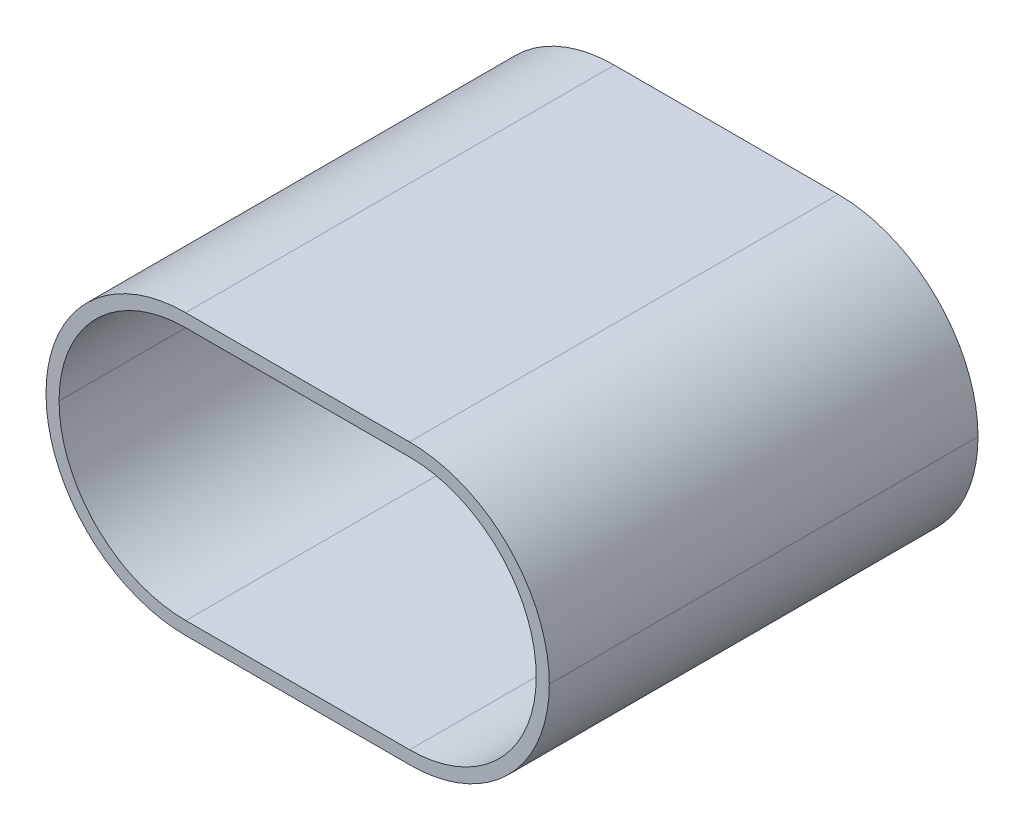
from build123d import *

# Parameters (mm, degrees)
EXTRUSION1_DEPTH        = 24
ENL_V_MAT_EXTRU_1_DEPTH = 1
EXTRUSION2_START        = -1
EXTRUSION2_DEPTH        = 1


with BuildPart() as part:
    # Esquisse1 → Extrusion1 (new body)
    with BuildSketch(Plane.XY):
        with BuildLine():
            Line((-8.829098079, -21.6), (3.180901921, -21.6))
            ThreePointArc((3.180901921, -21.6), (8.477131712, -19.406229791), (10.670901921, -14.11))
            Line((10.670901921, -14.11), (10.670901921, -14.1))
            ThreePointArc((10.670901921, -14.1), (8.47420278, -8.796699141), (3.170901921, -6.6))
            Line((3.170901921, -6.6), (-8.839098079, -6.6))
            ThreePointArc((-8.839098079, -6.6), (-14.13532787, -8.793770209), (-16.329098079, -14.09))
            Line((-16.329098079, -14.09), (-16.329098079, -14.1))
            ThreePointArc((-16.329098079, -14.1), (-14.132398938, -19.403300859), (-8.829098079, -21.6))
        make_face()
        with BuildLine():
            Line((3.170901921, -7.3), (-8.839098079, -7.3))
            ThreePointArc((-8.839098079, -7.3), (-13.640353124, -9.288744956), (-15.629098079, -14.09))
            Line((-15.629098079, -14.09), (-15.629098079, -14.1))
            ThreePointArc((-15.629098079, -14.1), (-13.637424191, -18.908326112), (-8.829098079, -20.9))
            Line((-8.829098079, -20.9), (3.180901921, -20.9))
            ThreePointArc((3.180901921, -20.9), (7.982156965, -18.911255044), (9.970901921, -14.11))
            Line((9.970901921, -14.11), (9.970901921, -14.1))
            ThreePointArc((9.970901921, -14.1), (7.979228033, -9.291673888), (3.170901921, -7.3))
        make_face(mode=Mode.SUBTRACT)
    extrude(amount=-EXTRUSION1_DEPTH)

    # Esquisse2 → Enlèv. mat.-Extru.1 (cut)
    with BuildSketch(Plane.XY):
        with BuildLine():
            Line((-8.829098079, -21.6), (3.180901921, -21.6))
            ThreePointArc((3.180901921, -21.6), (8.477131712, -19.406229791), (10.670901921, -14.11))
            Line((10.670901921, -14.11), (10.670901921, -14.1))
            ThreePointArc((10.670901921, -14.1), (8.47420278, -8.796699141), (3.170901921, -6.6))
            Line((3.170901921, -6.6), (-8.839098079, -6.6))
            ThreePointArc((-8.839098079, -6.6), (-14.13532787, -8.793770209), (-16.329098079, -14.09))
            Line((-16.329098079, -14.09), (-16.329098079, -14.1))
            ThreePointArc((-16.329098079, -14.1), (-14.132398938, -19.403300859), (-8.829098079, -21.6))
        make_face()
    extrude(amount=-ENL_V_MAT_EXTRU_1_DEPTH, mode=Mode.SUBTRACT)

    # Esquisse3 → Extrusion2 (add)
    with BuildSketch(Plane(origin=(0, 0, -24), x_dir=(-1, 0, 0), z_dir=(0, 0, -1)).offset(EXTRUSION2_START)):
        with BuildLine():
            Line((16.329098079, -14.1), (16.329098079, -14.09))
            ThreePointArc((16.329098079, -14.09), (14.13532787, -8.793770209), (8.839098079, -6.6))
            Line((8.839098079, -6.6), (-3.170901921, -6.6))
            ThreePointArc((-3.170901921, -6.6), (-8.47420278, -8.796699141), (-10.670901921, -14.1))
            Line((-10.670901921, -14.1), (-10.670901921, -14.11))
            ThreePointArc((-10.670901921, -14.11), (-8.477131712, -19.406229791), (-3.180901921, -21.6))
            Line((-3.180901921, -21.6), (8.829098079, -21.6))
            ThreePointArc((8.829098079, -21.6), (14.132398938, -19.403300859), (16.329098079, -14.1))
        make_face()
        with BuildLine():
            Line((8.839098079, -9.1), (-3.170901921, -9.1))
            ThreePointArc((-3.170901921, -9.1), (-6.706435827, -10.564466094), (-8.170901921, -14.1))
            Line((-8.170901921, -14.1), (-8.170901921, -14.11))
            ThreePointArc((-8.170901921, -14.11), (-6.709364759, -17.638462838), (-3.180901921, -19.1))
            Line((-3.180901921, -19.1), (8.829098079, -19.1))
            ThreePointArc((8.829098079, -19.1), (12.364631985, -17.635533906), (13.829098079, -14.1))
            Line((13.829098079, -14.1), (13.829098079, -14.09))
            ThreePointArc((13.829098079, -14.09), (12.367560918, -10.561537162), (8.839098079, -9.1))
        make_face(mode=Mode.SUBTRACT)
    extrude(amount=EXTRUSION2_DEPTH)


solid = part.part
